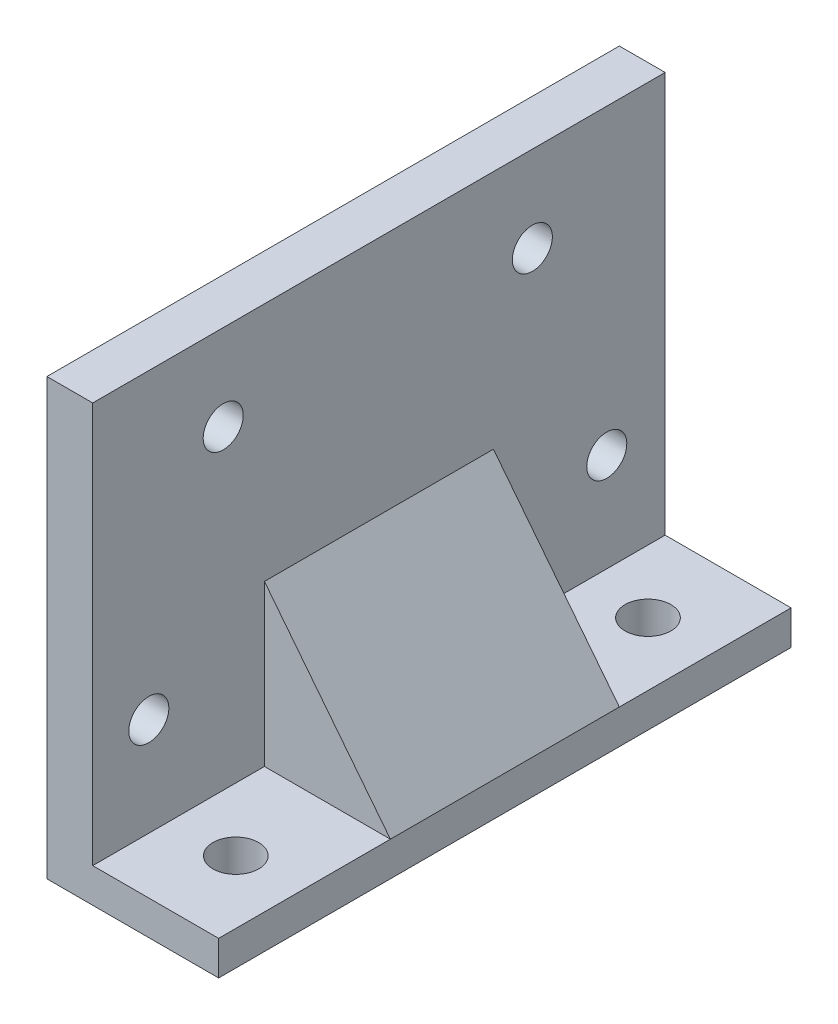
from build123d import *

# Parameters (mm, degrees)
BOSS_EXTRUDE1_DEPTH = 50
SKETCH2_W           = 11
SKETCH2_H           = 20
BOSS_EXTRUDE2_DEPTH = 30
CUT_EXTRUDE1_DEPTH  = 65.567793829
SKETCH4_R           = 1.75
CUT_EXTRUDE2_DEPTH  = 30
SKETCH5_R           = 2
CUT_EXTRUDE3_DEPTH  = 30
SKETCH6_W           = 11
SKETCH6_H           = 5.5
CUT_EXTRUDE4_DEPTH  = 2


with BuildPart() as part:
    # Sketch1 → Boss-Extrude1 (new body)
    with BuildSketch(Plane.XY):
        Polygon((0, 38), (0, 0), (15, 0), (15, 3), (4, 3), (4, 38), align=None)
    extrude(amount=BOSS_EXTRUDE1_DEPTH)

    # Sketch2 → Boss-Extrude2 (add)
    with BuildSketch(Plane(origin=(0, 3, 0), x_dir=(1, 0, 0), z_dir=(0, 1, 0))):
        with Locations((9.5, -25)):
            Rectangle(SKETCH2_W, SKETCH2_H)
    extrude(amount=BOSS_EXTRUDE2_DEPTH)

    # Sketch3 → Cut-Extrude1 (cut, through all)
    with BuildSketch(Plane.XY.offset(50)):
        Polygon((4, 33), (4, 17), (15, 3), (15, 33), align=None)
    extrude(amount=-CUT_EXTRUDE1_DEPTH, mode=Mode.SUBTRACT)

    # Sketch4 → Cut-Extrude2 (cut)
    with BuildSketch(Plane.ZY):
        with Locations(Location((5.1, 11.6, 0), (0, 0, 270))):
            Circle(SKETCH4_R)
        with Locations(Location((11.6, 30.5, 0), (0, 0, 270))):
            Circle(SKETCH4_R)
        with Locations(Location((45.1, 11.6, 0), (0, 0, 270))):
            Circle(SKETCH4_R)
        with Locations(Location((38.6, 30.5, 0), (0, 0, 270))):
            Circle(SKETCH4_R)
    extrude(amount=-CUT_EXTRUDE2_DEPTH, mode=Mode.SUBTRACT)

    # Sketch5 → Cut-Extrude3 (cut)
    with BuildSketch(Plane(origin=(0, 3, 0), x_dir=(1, 0, 0), z_dir=(0, 1, 0))):
        with Locations(Location((9.5, -43, 0), (0, 0, 270))):
            Circle(SKETCH5_R)
        with Locations(Location((9.5, -7, 0), (0, 0, 180))):
            Circle(SKETCH5_R)
    extrude(amount=-CUT_EXTRUDE3_DEPTH, mode=Mode.SUBTRACT)

    # Sketch6 → Cut-Extrude4 (cut)
    with BuildSketch(Plane.ZY):
        with Locations((34.35, 11.25)):
            Rectangle(SKETCH6_W, SKETCH6_H)
    extrude(amount=-CUT_EXTRUDE4_DEPTH, mode=Mode.SUBTRACT)


solid = part.part
